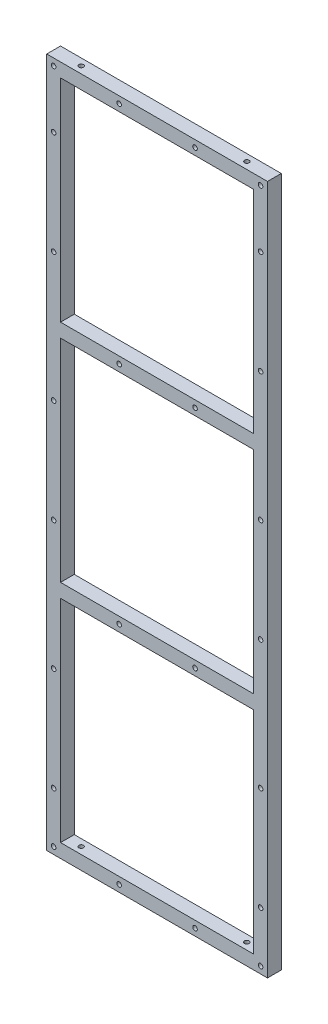
from build123d import *

# Parameters (mm, degrees)
SKETCH1_W           = 96
SKETCH1_H           = 300
SKETCH1_W_2         = 84
SKETCH1_H_2         = 92
BOSS_EXTRUDE1_DEPTH = 6
SKETCH2_R           = 1
CUT_EXTRUDE1_DEPTH  = 6
SKETCH4_R           = 1
CUT_EXTRUDE5_DEPTH  = 10
SKETCH3_R           = 1
CUT_EXTRUDE6_DEPTH  = 10


with BuildPart() as part:
    # Sketch1 → Boss-Extrude1 (new body)
    with BuildSketch(Plane.XY):
        Rectangle(SKETCH1_W, SKETCH1_H)
        with Locations((0, 98)):
            Rectangle(SKETCH1_W_2, SKETCH1_H_2, mode=Mode.SUBTRACT)
        with Locations((0, -98)):
            Rectangle(SKETCH1_W_2, SKETCH1_H_2, mode=Mode.SUBTRACT)
        Rectangle(SKETCH1_W_2, SKETCH1_H_2, mode=Mode.SUBTRACT)
    extrude(amount=BOSS_EXTRUDE1_DEPTH)

    # Sketch2 → Cut-Extrude1 (cut)
    with BuildSketch(Plane.XY.offset(6)):
        with Locations((-45, 147)):
            Circle(SKETCH2_R)
        with Locations((45, 147)):
            Circle(SKETCH2_R)
        with Locations((-45, -147)):
            Circle(SKETCH2_R)
        with Locations((45, -147)):
            Circle(SKETCH2_R)
    extrude(amount=-CUT_EXTRUDE1_DEPTH, mode=Mode.SUBTRACT)

    # Sketch4 → Cut-Extrude5 (cut)
    with BuildSketch(Plane(origin=(0, 150, 0), x_dir=(1, 0, 0), z_dir=(0, 1, 0))):
        with Locations(Location((-36, -3, 0), (0, 0, 270))):
            Circle(SKETCH4_R)
        with Locations(Location((36, -3, 0), (0, 0, 90))):
            Circle(SKETCH4_R)
    cut_extrude5 = extrude(amount=-CUT_EXTRUDE5_DEPTH, mode=Mode.SUBTRACT)

    # Mirror1: Cut-Extrude5 across plane
    add(cut_extrude5.mirror(Plane.ZX), mode=Mode.SUBTRACT)

    # Sketch3 → Cut-Extrude6 (cut)
    with BuildSketch(Plane.XY.offset(6)):
        with Locations((-45.000000047, 122)):
            Circle(SKETCH3_R)
        with Locations((-16.5, 147)):
            Circle(SKETCH3_R)
        with Locations(Location((16.5, 147, 0), (0, 0, 180))):
            Circle(SKETCH3_R)
        with Locations((-16.5, 49)):
            Circle(SKETCH3_R)
        with Locations(Location((16.5, 49, 0), (0, 0, 180))):
            Circle(SKETCH3_R)
        with Locations((-16.5, -49)):
            Circle(SKETCH3_R)
        with Locations(Location((16.5, -49, 0), (0, 0, 180))):
            Circle(SKETCH3_R)
        with Locations((-16.5, -147)):
            Circle(SKETCH3_R)
        with Locations(Location((16.5, -147, 0), (0, 0, 180))):
            Circle(SKETCH3_R)
        with Locations((-45.000000047, 21)):
            Circle(SKETCH3_R)
        with Locations((44.999999953, 122)):
            Circle(SKETCH3_R)
        with Locations((44.999999953, 77)):
            Circle(SKETCH3_R)
        with Locations((-45.000000047, 77)):
            Circle(SKETCH3_R)
        with Locations((44.999999953, 21)):
            Circle(SKETCH3_R)
        with Locations((44.999999953, -24)):
            Circle(SKETCH3_R)
        with Locations((-45.000000047, -24)):
            Circle(SKETCH3_R)
        with Locations((-45.000000047, -80)):
            Circle(SKETCH3_R)
        with Locations((44.999999953, -80)):
            Circle(SKETCH3_R)
        with Locations((44.999999953, -125)):
            Circle(SKETCH3_R)
        with Locations((-45.000000047, -125)):
            Circle(SKETCH3_R)
    extrude(amount=-CUT_EXTRUDE6_DEPTH, mode=Mode.SUBTRACT)


solid = part.part
